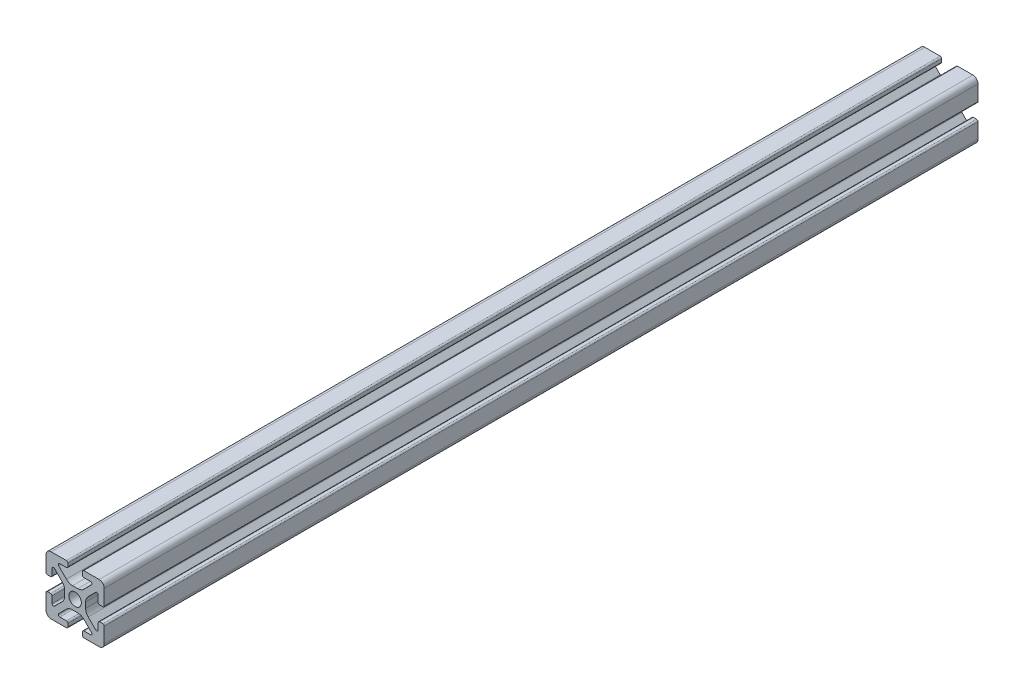
from build123d import *

# Parameters (mm, degrees)
BOSS_EXTRUDE1_DEPTH = 150


with BuildPart() as part:
    # Sketch4 → Boss-Extrude1 (new, symmetric)
    with BuildSketch(Plane.XY):
        with BuildLine():
            Line((3, -10), (8.25, -10))
            ThreePointArc((8.25, -10), (9.487436867, -9.487436867), (10, -8.25))
            Line((10, -8.25), (10, -3))
            ThreePointArc((10, -3), (9.853553391, -2.646446609), (9.5, -2.5))
            Line((9.5, -2.5), (8.424621202, -2.5))
            ThreePointArc((8.424621202, -2.5), (8.071067812, -2.646446609), (7.924621202, -3))
            Line((7.924621202, -3), (7.924621202, -5.25))
            ThreePointArc((7.924621202, -5.25), (7.615962919, -5.711939766), (7.071067812, -5.603553391))
            Line((7.071067812, -5.603553391), (4.478679656, -3.011165235))
            ThreePointArc((4.478679656, -3.011165235), (3.828361402, -2.037895189), (3.6, -0.889844892))
            Line((3.6, -0.889844892), (3.6, 0))
            Line((3.6, 0), (2.15, 0))
            ThreePointArc((2.15, 0), (1.52027958, -1.52027958), (0, -2.15))
            Line((0, -2.15), (0, -3.6))
            Line((0, -3.6), (0.889844892, -3.6))
            ThreePointArc((0.889844892, -3.6), (2.037895189, -3.828361402), (3.011165235, -4.478679656))
            Line((3.011165235, -4.478679656), (5.603553391, -7.071067812))
            ThreePointArc((5.603553391, -7.071067812), (5.711939766, -7.615962919), (5.25, -7.924621202))
            Line((5.25, -7.924621202), (3, -7.924621202))
            ThreePointArc((3, -7.924621202), (2.646446609, -8.071067812), (2.5, -8.424621202))
            Line((2.5, -8.424621202), (2.5, -9.5))
            ThreePointArc((2.5, -9.5), (2.646446609, -9.853553391), (3, -10))
        make_face()
    extrude(amount=BOSS_EXTRUDE1_DEPTH, both=True)

    # Mirror1: part across plane


with BuildPart() as part_1:
    add(part.part)
    add(part.part.mirror(Plane(origin=(0, 0, 0), x_dir=(0, 0, 1), z_dir=(1, 0, 0))))

    # Mirror2: part across plane


with BuildPart() as part_2:
    add(part_1.part)
    add(part_1.part.mirror(Plane.ZX))


solid = part_2.part
